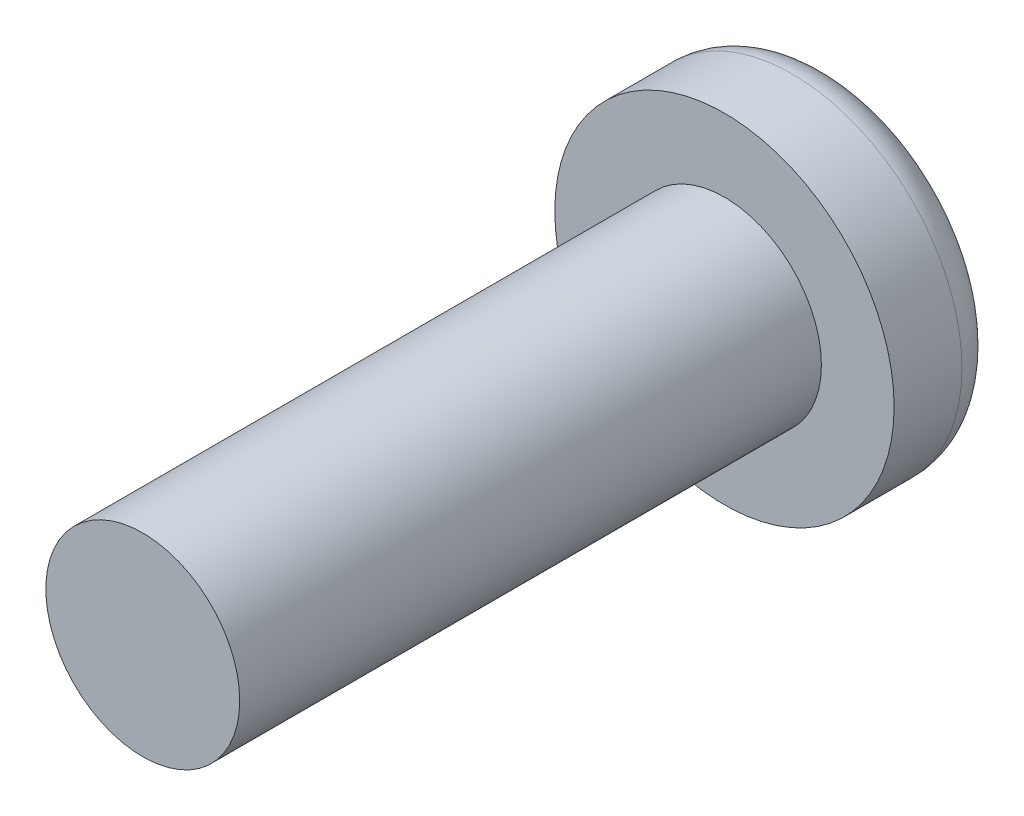
from build123d import *

# Parameters (mm, degrees)
SKETCH_1_R      = 5
EXTRUDE_1_DEPTH = 30
SKETCH_2_R      = 8.75
EXTRUDE_2_DEPTH = 5.5
FILLET_2_R      = 2


with BuildPart() as part:
    # 草图1 → 凸台-拉伸1 (new body)
    with BuildSketch(Plane.XY):
        Circle(SKETCH_1_R)
    extrude(amount=EXTRUDE_1_DEPTH)

    # Sketch 2 → 凸台-拉伸2 (add)
    with BuildSketch(Plane(origin=(0, 0, 0), x_dir=(-1, 0, 0), z_dir=(0, 0, -1))):
        Circle(SKETCH_2_R)
    extrude(amount=EXTRUDE_2_DEPTH)

    # 圆角2
    fillet_2_edges = [part.edges().sort_by_distance(p)[0] for p in [
        (8.75, 0, -5.5),
    ]]
    fillet(fillet_2_edges, radius=FILLET_2_R)


solid = part.part
